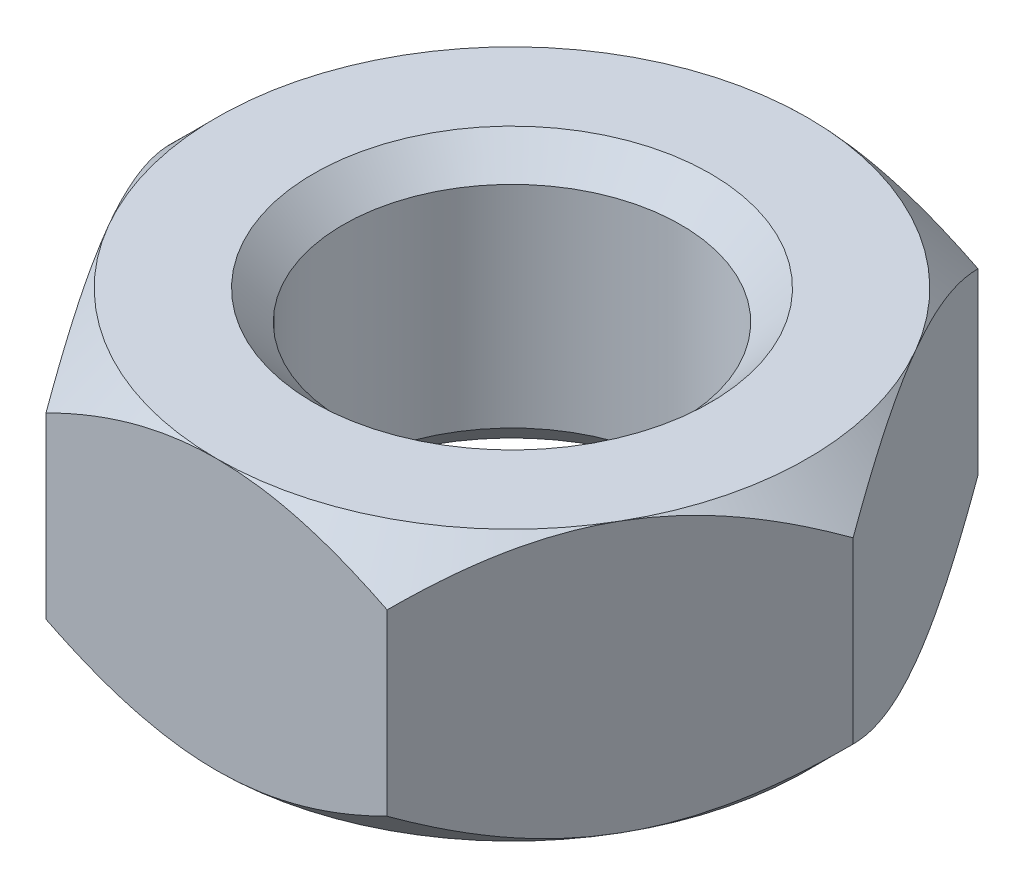
from build123d import *

# Parameters (mm, degrees)
SKETCH1_R           = 2
BOSS_EXTRUDE1_DEPTH = 3.2
CHAMFER1_SIZE       = 0.35


with BuildPart() as part:
    # Sketch1 → Boss-Extrude1 (new body)
    with BuildSketch(Plane(origin=(0, 0, 0), x_dir=(1, 0, 0), z_dir=(0, 1, 0))):
        Polygon((4.041451884, 0), (2.020725942, 3.5), (-2.020725942, 3.5), (-4.041451884, 0), (-2.020725942, -3.5), (2.020725942, -3.5), align=None)
        with Locations(Location((0, 0, 0), (0, 0, 270))):
            Circle(SKETCH1_R, mode=Mode.SUBTRACT)
    extrude(amount=BOSS_EXTRUDE1_DEPTH)

    # Sketch3 → Cut-Revolve1 (revolve, cut)
    with BuildSketch(Plane(origin=(0, 0, 0), x_dir=(0, 0, -1), z_dir=(1, 0, 0))):
        Polygon((-3.5, 0), (-4.1, 0.6), (-4.1, 0), align=None)
        Polygon((-4.1, 3.2), (-3.5, 3.2), (-4.1, 2.6), align=None)
    revolve(axis=Axis((0, 0, 0), (0, 1, 0)), mode=Mode.SUBTRACT)

    # Chamfer1
    chamfer1_edges = [part.edges().sort_by_distance(p)[0] for p in [
        (0, 0, -2),
        (0, 3.2, -2),
    ]]
    chamfer(chamfer1_edges, length=CHAMFER1_SIZE)


solid = part.part
